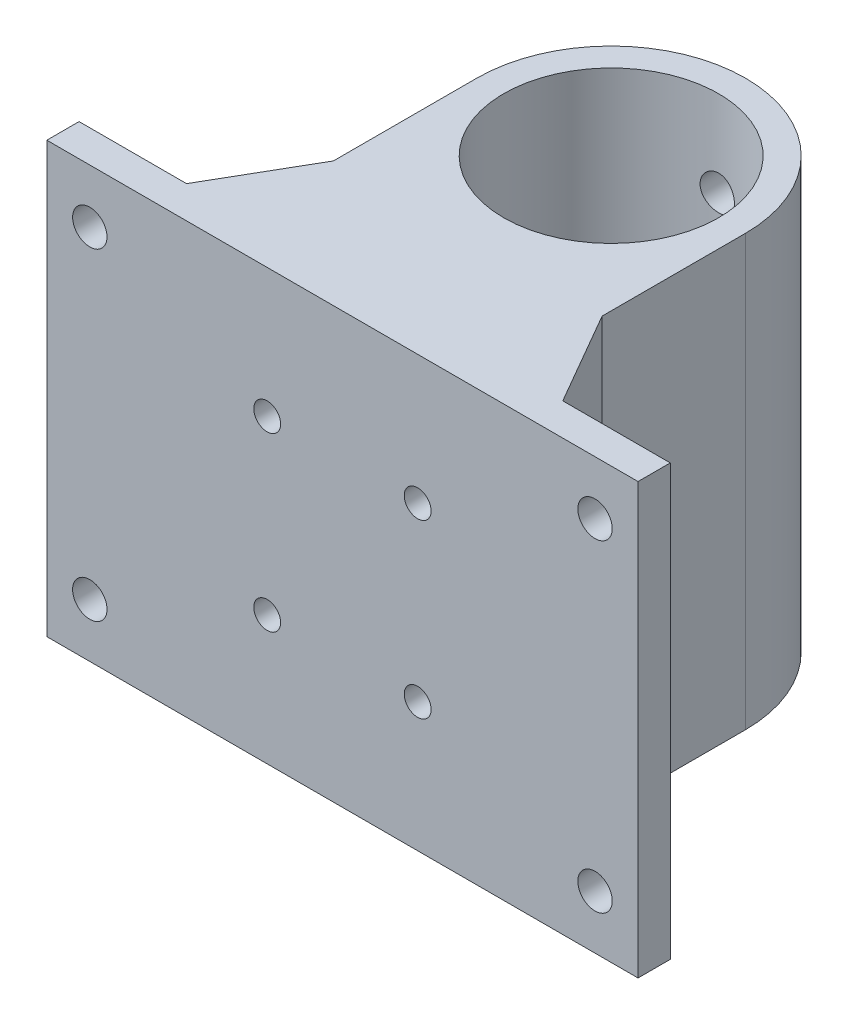
from build123d import *
from OCP.BRepFilletAPI import BRepFilletAPI_MakeChamfer

# Parameters (mm, degrees)
SKETCH_1_R             = 10
EXTRUDE_1_DEPTH        = 20
SKETCH_7_R             = 1.6
CUT_EXTRUDE_2_DEPTH    = 35.369317712
HOLE_WIZARD_M3_1_D     = 2.5
HOLE_WIZARD_M3_1_DEPTH = 9.5
HOLE_WIZARD_M3_1_TIP   = 0.751075774
SKETCH_9_W             = 3
SKETCH_9_H             = 40
EXTRUDE_2_DEPTH        = 15
SKETCH_10_R            = 1.6
CUT_EXTRUDE_3_DEPTH    = 49.440685492
CHAMFER_1_SIZE         = 5
CHAMFER_1_SIZE2        = 8.660254038


with BuildPart() as part:
    # 草图1 → 凸台-拉伸1 (new, symmetric)
    with BuildSketch(Plane(origin=(0, 0, 0), x_dir=(1, 0, 0), z_dir=(0, 1, 0))):
        with BuildLine():
            Line((-12.5, -25), (12.5, -25))
            Line((12.5, -25), (12.5, 0))
            ThreePointArc((12.5, 0), (0, 12.5), (-12.5, 0))
            Line((-12.5, 0), (-12.5, -25))
        make_face()
        with Locations(Location((0, 0, 0), (0, 0, 270))):
            Circle(SKETCH_1_R, mode=Mode.SUBTRACT)
    extrude(amount=EXTRUDE_1_DEPTH, both=True)

    # 草图7 → 切除-拉伸2 (cut, through all)
    with BuildSketch(Plane.XY):
        with Locations(Location((0, -12, 0), (0, 0, 90))):
            Circle(SKETCH_7_R)
        with Locations(Location((0, 12, 0), (0, 0, 90))):
            Circle(SKETCH_7_R)
    extrude(amount=-CUT_EXTRUDE_2_DEPTH, mode=Mode.SUBTRACT)

    # M3 螺纹孔1
    with Locations(Plane(origin=(-7, -8, 25), x_dir=(1, 0, 0), z_dir=(0, 0, 1))):
        with Locations((0, 0), (14, 0), (14, 16), (0, 16)):
            Hole(HOLE_WIZARD_M3_1_D / 2, depth=HOLE_WIZARD_M3_1_DEPTH)
            with Locations((0, 0, -(HOLE_WIZARD_M3_1_DEPTH + HOLE_WIZARD_M3_1_TIP / 2))):  # 118° drill point
                Cone(0, HOLE_WIZARD_M3_1_D / 2, HOLE_WIZARD_M3_1_TIP, mode=Mode.SUBTRACT)

    # 草图9 → 凸台-拉伸2 (add)
    with BuildSketch(Plane(origin=(12.5, 0, 0), x_dir=(0, 0, -1), z_dir=(1, 0, 0))):
        with Locations((-23.5, 0)):
            Rectangle(SKETCH_9_W, SKETCH_9_H)
    extrude_2 = extrude(amount=EXTRUDE_2_DEPTH)

    # 草图10 → 切除-拉伸3 (cut, through all)
    with BuildSketch(Plane(origin=(0, 0, 22), x_dir=(-1, 0, 0), z_dir=(0, 0, -1))):
        with Locations((-23.5, 15)):
            Circle(SKETCH_10_R)
        with Locations(Location((-23.5, -15, 0), (0, 0, 180))):
            Circle(SKETCH_10_R)
    cut_extrude_3 = extrude(amount=-CUT_EXTRUDE_3_DEPTH, mode=Mode.SUBTRACT)

    # 镜向6: 凸台-拉伸2, 切除-拉伸3 across plane
    add(extrude_2.mirror(Plane(origin=(0, 0, 0), x_dir=(0, 0, 1), z_dir=(1, 0, 0))))
    add(cut_extrude_3.mirror(Plane(origin=(0, 0, 0), x_dir=(0, 0, 1), z_dir=(1, 0, 0))), mode=Mode.SUBTRACT)

    # 倒角1: one chamfer whose edges measure the first distance from different faces: ONE call of the kernel's chamfer builder (chamfer() names one face for all edges)
    chamfer_1_edges_1 = [part.edges().sort_by_distance(p)[0] for p in [
        (12.5, 0, 22),
    ]]
    chamfer_1_side_1 = [part.faces().sort_by_distance(p)[0] for p in [
        (19.903586419, 0, 22),
    ]]
    chamfer_1_edges_2 = [part.edges().sort_by_distance(p)[0] for p in [
        (-12.5, 0, 22),
    ]]
    chamfer_1_side_2 = [part.faces().sort_by_distance(p)[0] for p in [
        (-19.903586419, 0, 22),
    ]]
    chamfer_1 = BRepFilletAPI_MakeChamfer(part.part.solid().wrapped)
    for e in chamfer_1_edges_1:
        chamfer_1.Add(CHAMFER_1_SIZE, CHAMFER_1_SIZE2, e.wrapped, chamfer_1_side_1[0].wrapped)  # the first distance lies on this face
    for e in chamfer_1_edges_2:
        chamfer_1.Add(CHAMFER_1_SIZE, CHAMFER_1_SIZE2, e.wrapped, chamfer_1_side_2[0].wrapped)  # the first distance lies on this face
    add(Compound.cast(chamfer_1.Shape()), mode=Mode.REPLACE)


solid = part.part
